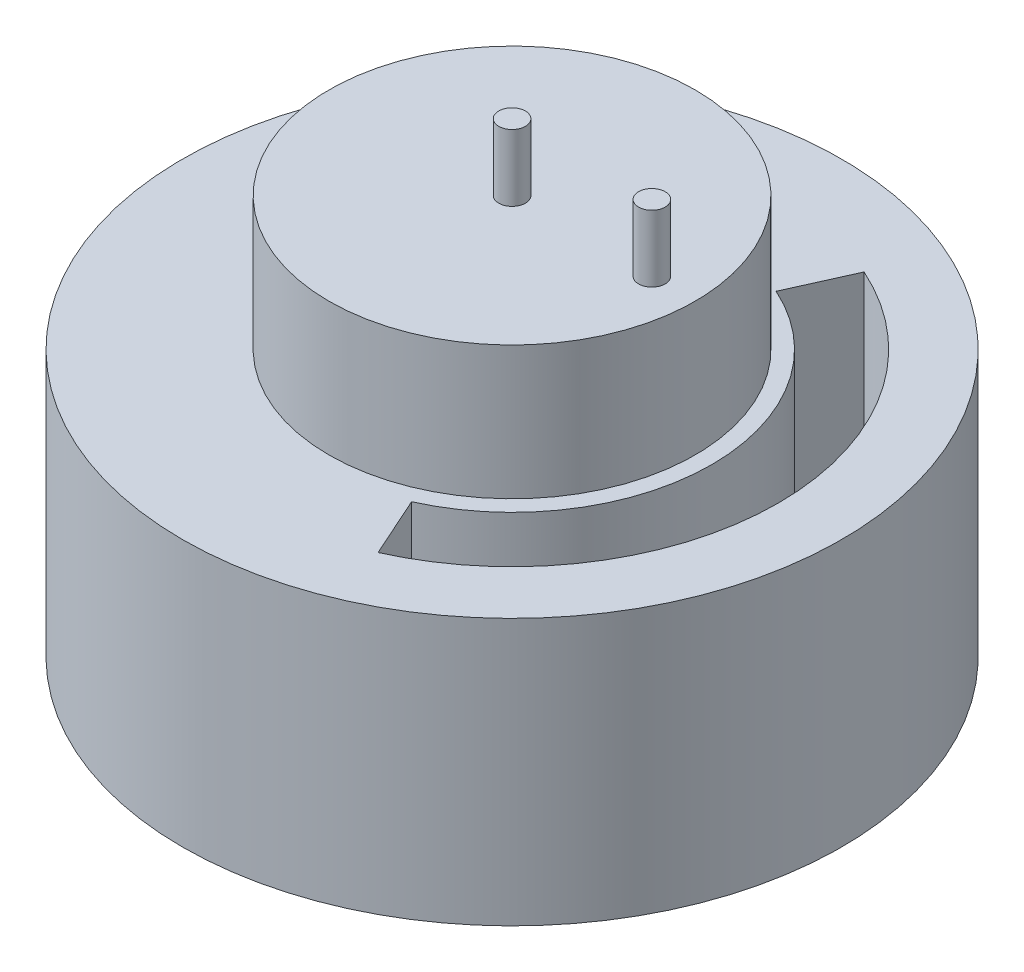
from build123d import *

# Parameters (mm, degrees)
RESSALTO_EXTRUS_O2_DEPTH = 20
ESBO_O3_R                = 13.75
BOSS_EXTRUDE1_DEPTH      = 10
SKETCH2_R                = 1
BOSS_EXTRUDE2_DEPTH      = 5
CUT_EXTRUDE2_DEPTH       = 20


with BuildPart() as part:
    # Esboço1 → Ressalto-extrusão2 (new body)
    with BuildSketch(Plane(origin=(0, 0, 0), x_dir=(1, 0, 0), z_dir=(0, 1, 0))):
        with BuildLine():
            ThreePointArc((-12.375, -21.434128744), (0, -24.75), (12.375, -21.434128744))
            ThreePointArc((12.375, -21.434128744), (21.434128744, -12.375), (24.75, 0))
            ThreePointArc((24.75, 0), (-12.375, 21.434128744), (-12.375, -21.434128744))
        make_face()
    extrude(amount=RESSALTO_EXTRUS_O2_DEPTH)

    # Esboço3 → Boss-Extrude1 (add)
    with BuildSketch(Plane(origin=(0, 20, 0), x_dir=(1, 0, 0), z_dir=(0, 1, 0))):
        with Locations(Location((0, 0, 0), (0, 0, 270))):
            Circle(ESBO_O3_R)
    extrude(amount=BOSS_EXTRUDE1_DEPTH)

    # Sketch2 → Boss-Extrude2 (add)
    with BuildSketch(Plane(origin=(0, 30, 0), x_dir=(1, 0, 0), z_dir=(0, 1, 0))):
        with Locations(Location((0, 0, 0), (0, 0, 270))):
            Circle(SKETCH2_R)
        with Locations(Location((10.5, 0, 0), (0, 0, 270))):
            Circle(SKETCH2_R)
    extrude(amount=BOSS_EXTRUDE2_DEPTH)

    # Sketch3 → Cut-Extrude2 (cut)
    with BuildSketch(Plane(origin=(0, 20, 0), x_dir=(1, 0, 0), z_dir=(0, 1, 0))):
        with BuildLine():
            Line((8.185723081, -18.248121483), (6.13929231, -13.686091112))
            ThreePointArc((6.13929231, -13.686091112), (15, 0), (6.13929231, 13.686091112))
            Line((6.13929231, 13.686091112), (8.185723081, 18.248121483))
            ThreePointArc((8.185723081, 18.248121483), (20, 0), (8.185723081, -18.248121483))
        make_face()
    extrude(amount=-CUT_EXTRUDE2_DEPTH, mode=Mode.SUBTRACT)


solid = part.part
